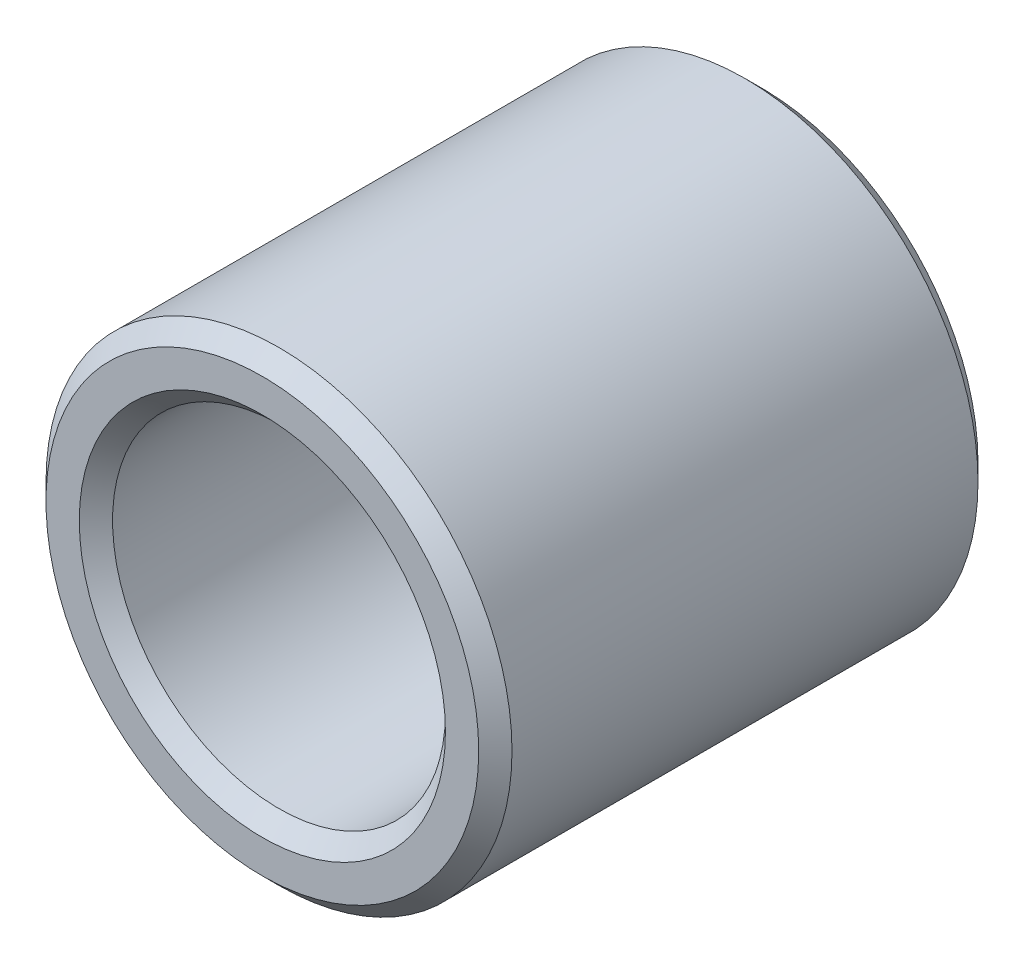
from build123d import *

# Parameters (mm, degrees)
SKETCH_1_R      = 7
SKETCH_1_R_2    = 5
EXTRUDE_1_DEPTH = 15
CHAMFER_1_SIZE  = 0.5


with BuildPart() as part:
    # Эскиз1 → Бобышка-Вытянуть1 (new body)
    with BuildSketch(Plane.XY):
        Circle(SKETCH_1_R)
        Circle(SKETCH_1_R_2, mode=Mode.SUBTRACT)
    extrude(amount=EXTRUDE_1_DEPTH)

    # Фаска1
    chamfer_1_edges = [part.edges().sort_by_distance(p)[0] for p in [
        (-7, 0, 0),
        (-7, 0, 15),
        (-5, 0, 0),
        (-5, 0, 15),
    ]]
    chamfer(chamfer_1_edges, length=CHAMFER_1_SIZE)


solid = part.part
